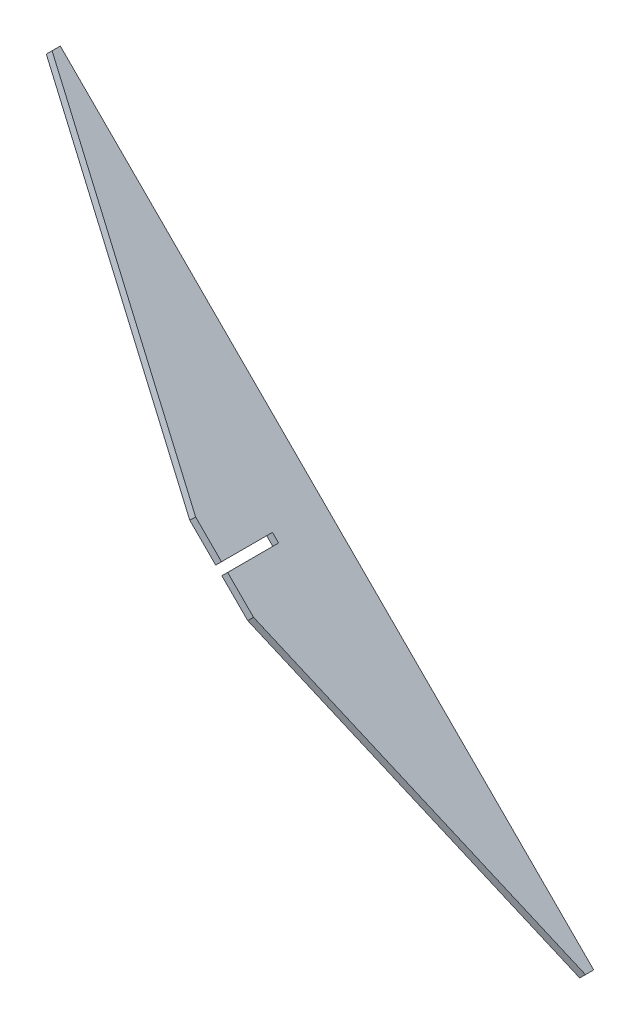
from build123d import *

# Parameters (mm, degrees)
BOSS_EXTRUDE1_DEPTH      = 115
BOSS_EXTRUDE1_DEPTH_BACK = 10
CUT_EXTRUDE1_DEPTH       = 10
SKETCH4_W                = 10.6
SKETCH4_H                = 62.2
CUT_EXTRUDE2_DEPTH       = 708.343268859


with BuildPart() as part:
    # Sketch2 → Boss-Extrude1 (new, two sides: drawn at the far end of the back side and taken through both)
    with BuildSketch(Plane.XY.offset(-BOSS_EXTRUDE1_DEPTH_BACK)):
        Polygon((321.928932188, 0), (329, 7.071067812), (-321.928932188, 658), (-329, 650.928932188), align=None)
    extrude(amount=BOSS_EXTRUDE1_DEPTH + BOSS_EXTRUDE1_DEPTH_BACK)

    # Sketch3 → Cut-Extrude1 (cut)
    with BuildSketch(Plane(origin=(160.964466094, 160.964466094, 0), x_dir=(-0.7071067811865476, 0.7071067811865476, 0), z_dir=(-0.7071067811865476, -0.7071067811865476, 0))):
        Polygon((-227.63813101, -115), (182.63813101, -115), (-227.63813101, 0), align=None)
        Polygon((692.914393031, -115), (282.63813101, -115), (692.914393031, 0), align=None)
    extrude(amount=-CUT_EXTRUDE1_DEPTH, mode=Mode.SUBTRACT)

    # Sketch4 → Cut-Extrude2 (cut, through all)
    with BuildSketch(Plane(origin=(160.964466094, 160.964466094, 0), x_dir=(-0.7071067811865476, 0.7071067811865476, 0), z_dir=(-0.7071067811865476, -0.7071067811865476, 0))):
        with Locations((232.63813101, -83.9)):
            Rectangle(SKETCH4_W, SKETCH4_H)
    extrude(amount=-CUT_EXTRUDE2_DEPTH, mode=Mode.SUBTRACT)


solid = part.part
